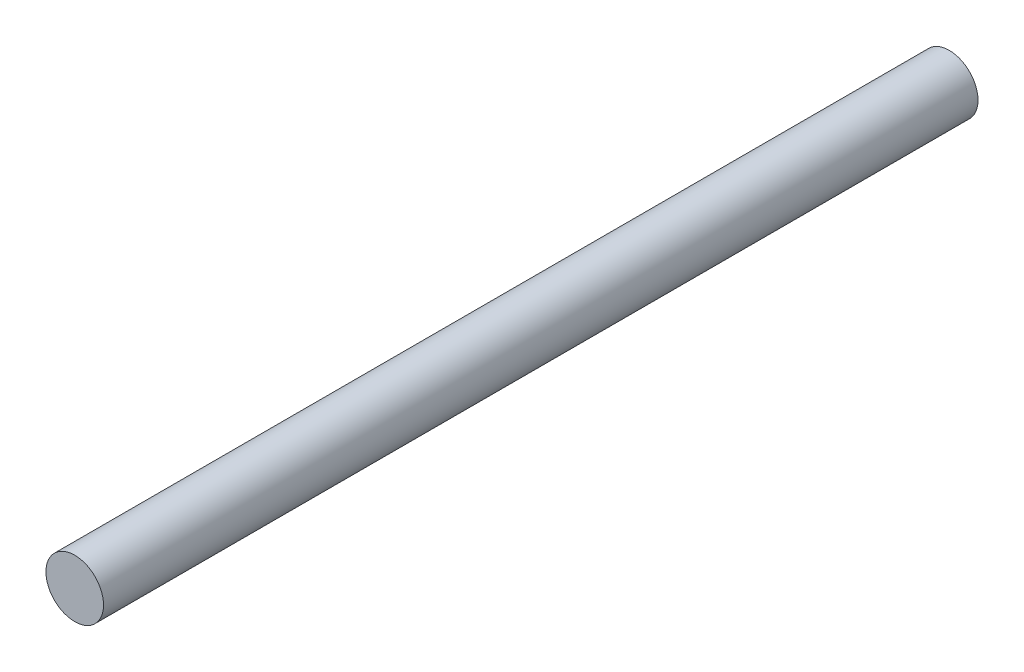
from build123d import *

# Parameters (mm, degrees)
SKETCH_1_R      = 3.95
EXTRUDE_1_DEPTH = 120


with BuildPart() as part:
    # Эскиз1 → Бобышка-Вытянуть1 (new body)
    with BuildSketch(Plane.XY):
        Circle(SKETCH_1_R)
    extrude(amount=EXTRUDE_1_DEPTH)


solid = part.part
